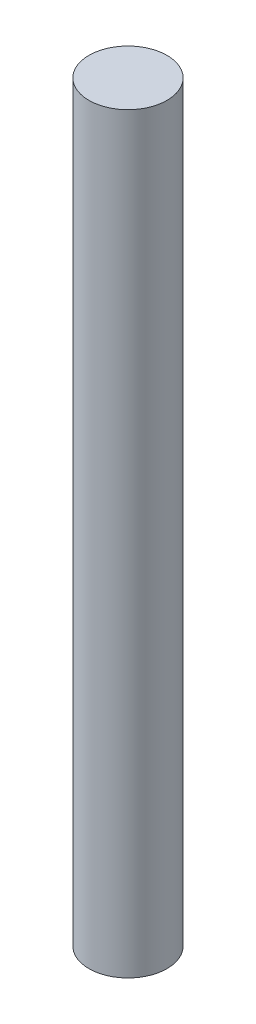
from build123d import *

# Parameters (mm, degrees)
SCHIZZO2_R                    = 2.495
ESTRUSIONE_ESTRUSIONE1_DEPTH  = 48.09
TAGLIO_ESTRUSIONE1_DEPTH      = 49.219271562
TAGLIO_ESTRUSIONE1_DEPTH_BACK = 49.219271562
SCHIZZO3_W                    = 0.85
SCHIZZO3_H                    = 4.01


with BuildPart() as part:
    # Schizzo2 → Estrusione-Estrusione1 (new body)
    with BuildSketch(Plane(origin=(0, 0, 0), x_dir=(1, 0, 0), z_dir=(0, 1, 0))):
        with Locations(Location((0, 0, 0), (0, 0, 270))):
            Circle(SCHIZZO2_R)
    extrude(amount=ESTRUSIONE_ESTRUSIONE1_DEPTH)

    # Schizzo3 → Taglio-Estrusione1 (cut, two sides: drawn at the far end of the back side and taken through both)
    with BuildSketch(Plane.XY.offset(-TAGLIO_ESTRUSIONE1_DEPTH_BACK)):
        with Locations((-2.07, 45.25)):
            Rectangle(SCHIZZO3_W, SCHIZZO3_H)
        with Locations((-2.07, 2.84)):
            Rectangle(SCHIZZO3_W, SCHIZZO3_H)
    extrude(amount=TAGLIO_ESTRUSIONE1_DEPTH + TAGLIO_ESTRUSIONE1_DEPTH_BACK, mode=Mode.SUBTRACT)


solid = part.part
